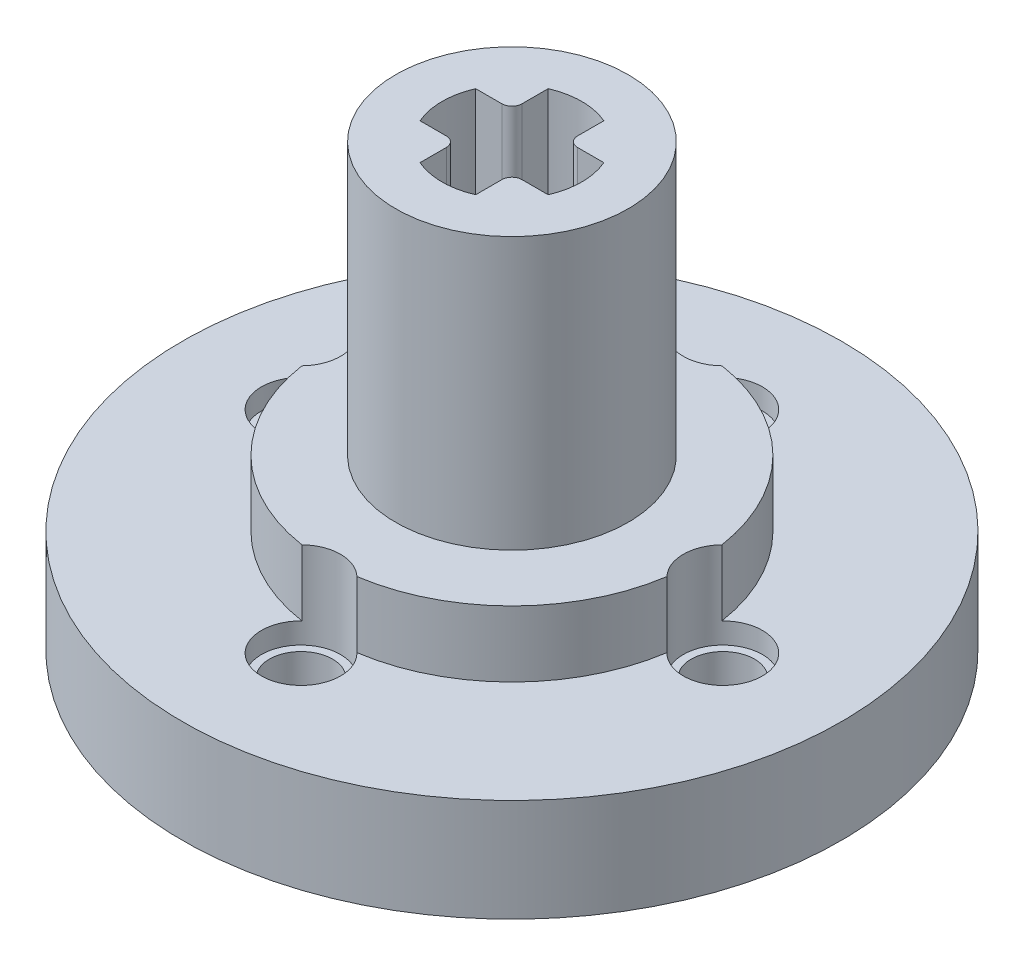
from build123d import *

# Parameters (mm, degrees)
CUT_EXTRUDE1_REACH             = 26.319
SKETCH3_R                      = 1.5
CUT_EXTRUDE2_DEPTH             = 0.79375
CUT_EXTRUDE2_DIRECTION_2_REACH = 23.825
CUT_EXTRUDE3_REACH             = 23.825
SKETCH5_R                      = 1.2


with BuildPart() as part:
    # Sketch1 → Revolve1 (revolve)
    with BuildSketch(Plane.XY, mode=Mode.PRIVATE) as revolve1_sk:
        Polygon((0, 0), (0, 16.7), (4.41, 16.7), (4.41, 6.4), (7, 6.4), (7, 3.9), (12.5, 3.9), (12.5, 0), align=None)
    revolve(revolve1_sk.sketch.rotate(Axis((0, 0, 0), (0, 1, 0)), 90), axis=Axis((0, 0, 0), (0, 1, 0)))

    # Sketch2 → Cut-Extrude1 (cut, up to next)
    with BuildSketch(Plane(origin=(0, 16.7, 0), x_dir=(1, 0, 0), z_dir=(0, 1, 0)), mode=Mode.PRIVATE) as cut_extrude1_sk1:
        with BuildLine():
            Line((-0.935, -1.435), (-0.935, -2.35))
            ThreePointArc((-0.935, -2.35), (0, -2.529174767), (0.935, -2.35))
            Line((0.935, -2.35), (0.935, -1.435))
            ThreePointArc((0.935, -1.435), (1.081446609, -1.081446609), (1.435, -0.935))
            Line((1.435, -0.935), (2.35, -0.935))
            ThreePointArc((2.35, -0.935), (2.529174767, 0), (2.35, 0.935))
            Line((2.35, 0.935), (1.435, 0.935))
            ThreePointArc((1.435, 0.935), (1.081446609, 1.081446609), (0.935, 1.435))
            Line((0.935, 1.435), (0.935, 2.35))
            ThreePointArc((0.935, 2.35), (0, 2.529174767), (-0.935, 2.35))
            Line((-0.935, 2.35), (-0.935, 1.435))
            ThreePointArc((-0.935, 1.435), (-1.081446609, 1.081446609), (-1.435, 0.935))
            Line((-1.435, 0.935), (-2.35, 0.935))
            ThreePointArc((-2.35, 0.935), (-2.529174767, 0), (-2.35, -0.935))
            Line((-2.35, -0.935), (-1.435, -0.935))
            ThreePointArc((-1.435, -0.935), (-1.081446609, -1.081446609), (-0.935, -1.435))
        make_face()
    cut_extrude1_tool1 = extrude(cut_extrude1_sk1.sketch, amount=-CUT_EXTRUDE1_REACH, mode=Mode.PRIVATE) & part.part
    # Sketch2 → Cut-Extrude1 (cut, up to next)
    with BuildSketch(Plane(origin=(0, 16.7, 0), x_dir=(1, 0, 0), z_dir=(0, 1, 0)), mode=Mode.PRIVATE) as cut_extrude1_sk2:
        with BuildLine():
            Line((-2.430041552, -1.055), (-1.435, -1.055))
            ThreePointArc((-1.435, -1.055), (-1.166299423, -1.166299423), (-1.055, -1.435))
            Line((-1.055, -1.435), (-1.055, -2.430041552))
            ThreePointArc((-1.055, -2.430041552), (0, -2.649174767), (1.055, -2.430041552))
            Line((1.055, -2.430041552), (1.055, -1.435))
            ThreePointArc((1.055, -1.435), (1.166299423, -1.166299423), (1.435, -1.055))
            Line((1.435, -1.055), (2.430041552, -1.055))
            ThreePointArc((2.430041552, -1.055), (2.649174767, 0), (2.430041552, 1.055))
            Line((2.430041552, 1.055), (1.435, 1.055))
            ThreePointArc((1.435, 1.055), (1.166299423, 1.166299423), (1.055, 1.435))
            Line((1.055, 1.435), (1.055, 2.430041552))
            ThreePointArc((1.055, 2.430041552), (0, 2.649174767), (-1.055, 2.430041552))
            Line((-1.055, 2.430041552), (-1.055, 1.435))
            ThreePointArc((-1.055, 1.435), (-1.166299423, 1.166299423), (-1.435, 1.055))
            Line((-1.435, 1.055), (-2.430041552, 1.055))
            ThreePointArc((-2.430041552, 1.055), (-2.649174767, 0), (-2.430041552, -1.055))
        make_face()
    cut_extrude1_tool2 = extrude(cut_extrude1_sk2.sketch, amount=-CUT_EXTRUDE1_REACH, mode=Mode.PRIVATE) & part.part
    add(cut_extrude1_tool1.solids().sort_by_distance((0, 16.7, 0))[0], mode=Mode.SUBTRACT)
    add(cut_extrude1_tool2.solids().sort_by_distance((0, 16.7, 0))[0], mode=Mode.SUBTRACT)

    # Sketch3 → Cut-Extrude2 (cut)
    with BuildSketch(Plane(origin=(0, 3.9, 0), x_dir=(1, 0, 0), z_dir=(0, 1, 0))):
        with Locations(Location((0, 8, 0), (0, 0, 314.048625674))):
            Circle(SKETCH3_R)
        with Locations(Location((0, -8, 0), (0, 0, 90))):
            Circle(SKETCH3_R)
        with Locations(Location((-8, 0, 0), (0, 0, 44.048625674))):
            Circle(SKETCH3_R)
        with Locations(Location((8, 0, 0), (0, 0, 90))):
            Circle(SKETCH3_R)
    extrude(amount=-CUT_EXTRUDE2_DEPTH, mode=Mode.SUBTRACT)

    # Cut-Extrude2 direction 2: up to this face of the body (flat: up to its plane)
    cut_extrude2_direction_2_end = Plane(part.part.faces().sort_by_distance((0, 6.4, 4.607989899))[0])
    # Sketch3 → Cut-Extrude2 direction 2 (cut, up to the picked face)
    with BuildSketch(Plane(origin=(0, 3.9, 0), x_dir=(1, 0, 0), z_dir=(0, 1, 0)), mode=Mode.PRIVATE) as cut_extrude2_direction_2_sk1:
        with Locations(Location((0, 8, 0), (0, 0, 314.048625674))):
            Circle(SKETCH3_R)
    cut_extrude2_direction_2_tool1 = split(extrude(cut_extrude2_direction_2_sk1.sketch, amount=CUT_EXTRUDE2_DIRECTION_2_REACH, mode=Mode.PRIVATE), bisect_by=cut_extrude2_direction_2_end, keep=Keep.BOTH, mode=Mode.PRIVATE)
    # Sketch3 → Cut-Extrude2 direction 2 (cut, up to the picked face)
    with BuildSketch(Plane(origin=(0, 3.9, 0), x_dir=(1, 0, 0), z_dir=(0, 1, 0)), mode=Mode.PRIVATE) as cut_extrude2_direction_2_sk2:
        with Locations(Location((0, -8, 0), (0, 0, 90))):
            Circle(SKETCH3_R)
    cut_extrude2_direction_2_tool2 = split(extrude(cut_extrude2_direction_2_sk2.sketch, amount=CUT_EXTRUDE2_DIRECTION_2_REACH, mode=Mode.PRIVATE), bisect_by=cut_extrude2_direction_2_end, keep=Keep.BOTH, mode=Mode.PRIVATE)
    # Sketch3 → Cut-Extrude2 direction 2 (cut, up to the picked face)
    with BuildSketch(Plane(origin=(0, 3.9, 0), x_dir=(1, 0, 0), z_dir=(0, 1, 0)), mode=Mode.PRIVATE) as cut_extrude2_direction_2_sk3:
        with Locations(Location((-8, 0, 0), (0, 0, 44.048625674))):
            Circle(SKETCH3_R)
    cut_extrude2_direction_2_tool3 = split(extrude(cut_extrude2_direction_2_sk3.sketch, amount=CUT_EXTRUDE2_DIRECTION_2_REACH, mode=Mode.PRIVATE), bisect_by=cut_extrude2_direction_2_end, keep=Keep.BOTH, mode=Mode.PRIVATE)
    # Sketch3 → Cut-Extrude2 direction 2 (cut, up to the picked face)
    with BuildSketch(Plane(origin=(0, 3.9, 0), x_dir=(1, 0, 0), z_dir=(0, 1, 0)), mode=Mode.PRIVATE) as cut_extrude2_direction_2_sk4:
        with Locations(Location((8, 0, 0), (0, 0, 90))):
            Circle(SKETCH3_R)
    cut_extrude2_direction_2_tool4 = split(extrude(cut_extrude2_direction_2_sk4.sketch, amount=CUT_EXTRUDE2_DIRECTION_2_REACH, mode=Mode.PRIVATE), bisect_by=cut_extrude2_direction_2_end, keep=Keep.BOTH, mode=Mode.PRIVATE)
    add(cut_extrude2_direction_2_tool1.solids().sort_by(Axis((0, 3.9, -8), (0, 1, 0)))[0], mode=Mode.SUBTRACT)
    add(cut_extrude2_direction_2_tool2.solids().sort_by(Axis((0, 3.9, 8), (0, 1, 0)))[0], mode=Mode.SUBTRACT)
    add(cut_extrude2_direction_2_tool3.solids().sort_by(Axis((-8, 3.9, 0), (0, 1, 0)))[0], mode=Mode.SUBTRACT)
    add(cut_extrude2_direction_2_tool4.solids().sort_by(Axis((8, 3.9, 0), (0, 1, 0)))[0], mode=Mode.SUBTRACT)

    # Sketch5 → Cut-Extrude3 (cut, up to next)
    with BuildSketch(Plane(origin=(0, 3.9, 0), x_dir=(1, 0, 0), z_dir=(0, 1, 0)), mode=Mode.PRIVATE) as cut_extrude3_sk1:
        with Locations(Location((8, 0, 0), (0, 0, 90))):
            Circle(SKETCH5_R)
    cut_extrude3_tool1 = extrude(cut_extrude3_sk1.sketch, amount=-CUT_EXTRUDE3_REACH, mode=Mode.PRIVATE) & part.part
    # Sketch5 → Cut-Extrude3 (cut, up to next)
    with BuildSketch(Plane(origin=(0, 3.9, 0), x_dir=(1, 0, 0), z_dir=(0, 1, 0)), mode=Mode.PRIVATE) as cut_extrude3_sk2:
        with Locations(Location((0, 8, 0), (0, 0, 270))):
            Circle(SKETCH5_R)
    cut_extrude3_tool2 = extrude(cut_extrude3_sk2.sketch, amount=-CUT_EXTRUDE3_REACH, mode=Mode.PRIVATE) & part.part
    # Sketch5 → Cut-Extrude3 (cut, up to next)
    with BuildSketch(Plane(origin=(0, 3.9, 0), x_dir=(1, 0, 0), z_dir=(0, 1, 0)), mode=Mode.PRIVATE) as cut_extrude3_sk3:
        with Locations(Location((-8, 0, 0), (0, 0, 270))):
            Circle(SKETCH5_R)
    cut_extrude3_tool3 = extrude(cut_extrude3_sk3.sketch, amount=-CUT_EXTRUDE3_REACH, mode=Mode.PRIVATE) & part.part
    # Sketch5 → Cut-Extrude3 (cut, up to next)
    with BuildSketch(Plane(origin=(0, 3.9, 0), x_dir=(1, 0, 0), z_dir=(0, 1, 0)), mode=Mode.PRIVATE) as cut_extrude3_sk4:
        with Locations(Location((0, -8, 0), (0, 0, 90))):
            Circle(SKETCH5_R)
    cut_extrude3_tool4 = extrude(cut_extrude3_sk4.sketch, amount=-CUT_EXTRUDE3_REACH, mode=Mode.PRIVATE) & part.part
    add(cut_extrude3_tool1.solids().sort_by_distance((8, 3.9, 0))[0], mode=Mode.SUBTRACT)
    add(cut_extrude3_tool2.solids().sort_by_distance((0, 3.9, -8))[0], mode=Mode.SUBTRACT)
    add(cut_extrude3_tool3.solids().sort_by_distance((-8, 3.9, 0))[0], mode=Mode.SUBTRACT)
    add(cut_extrude3_tool4.solids().sort_by_distance((0, 3.9, 8))[0], mode=Mode.SUBTRACT)


solid = part.part
